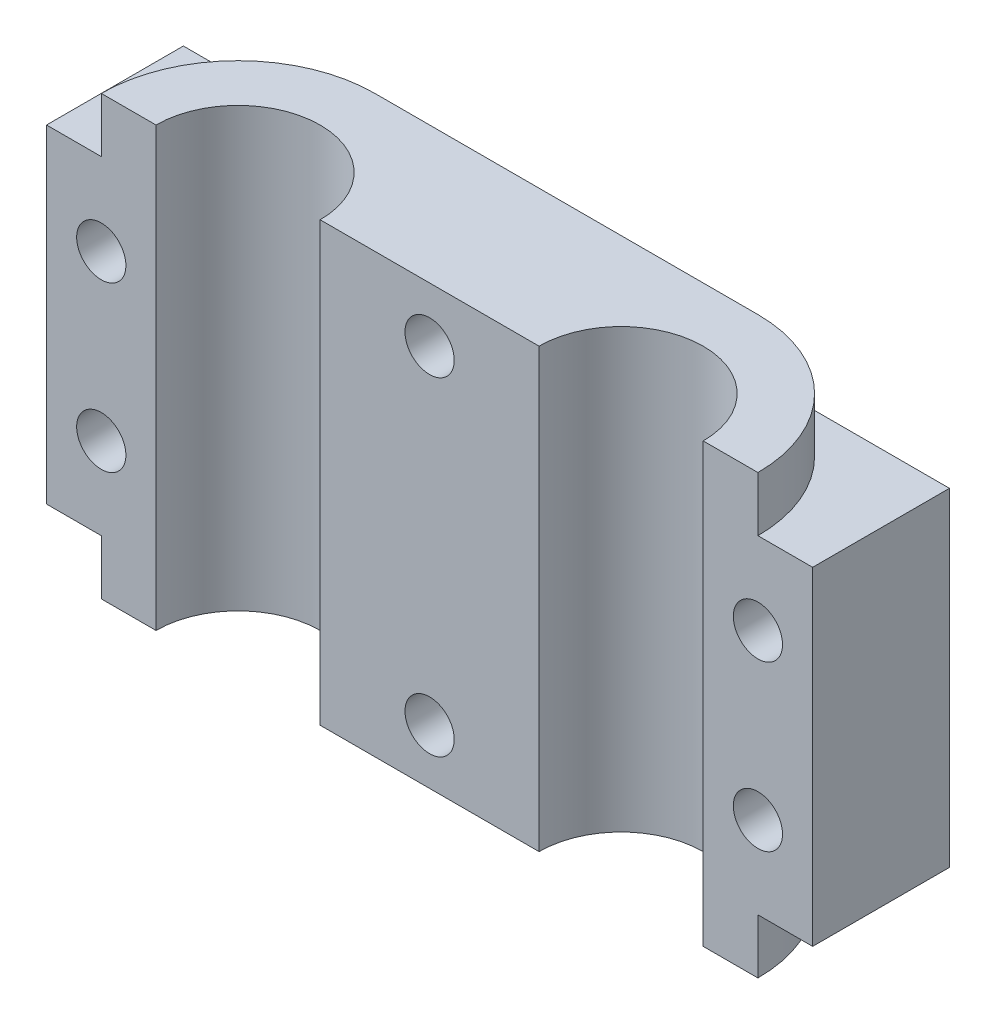
from build123d import *

# Parameters (mm, degrees)
BOSS_EXTRUDE1_DEPTH = 20
BOSS_EXTRUDE2_DEPTH = 15
SKETCH2_R           = 2.25
CUT_EXTRUDE1_DEPTH  = 12.5


with BuildPart() as part:
    # Sketch1 → Boss-Extrude1 (new, symmetric)
    with BuildSketch(Plane(origin=(0, 0, 0), x_dir=(1, 0, 0), z_dir=(0, 1, 0))):
        with BuildLine():
            ThreePointArc((-17.5, 0), (-26.338834765, -3.661165235), (-30, -12.5))
            Line((-30, -12.5), (-25, -12.5))
            ThreePointArc((-25, -12.5), (-17.5, -5), (-10, -12.5))
            Line((-10, -12.5), (10, -12.5))
            ThreePointArc((10, -12.5), (17.5, -5), (25, -12.5))
            Line((25, -12.5), (30, -12.5))
            ThreePointArc((30, -12.5), (26.338834765, -3.661165235), (17.5, 0))
            Line((17.5, 0), (-17.5, 0))
        make_face()
    extrude(amount=BOSS_EXTRUDE1_DEPTH, both=True)

    # Sketch1<3> → Boss-Extrude2 (add, symmetric)
    with BuildSketch(Plane(origin=(0, 0, 0), x_dir=(1, 0, 0), z_dir=(0, 1, 0))):
        with BuildLine():
            Line((-17.5, 0), (-35, 0))
            Line((-35, 0), (-35, -12.5))
            Line((-35, -12.5), (-30, -12.5))
            ThreePointArc((-30, -12.5), (-26.338834765, -3.661165235), (-17.5, 0))
        make_face()
        with BuildLine():
            Line((35, 0), (17.5, 0))
            ThreePointArc((17.5, 0), (26.338834765, -3.661165235), (30, -12.5))
            Line((30, -12.5), (35, -12.5))
            Line((35, -12.5), (35, 0))
        make_face()
    extrude(amount=BOSS_EXTRUDE2_DEPTH, both=True)

    # Sketch2 → Cut-Extrude1 (cut)
    with BuildSketch(Plane.XY.offset(12.5)):
        with Locations((0, 15)):
            Circle(SKETCH2_R)
        with Locations((0, -15)):
            Circle(SKETCH2_R)
        with Locations((-30, 7.5)):
            Circle(SKETCH2_R)
        with Locations((-30, -7.5)):
            Circle(SKETCH2_R)
        with Locations((30, -7.5)):
            Circle(SKETCH2_R)
        with Locations((30, 7.5)):
            Circle(SKETCH2_R)
    extrude(amount=-CUT_EXTRUDE1_DEPTH, mode=Mode.SUBTRACT)


solid = part.part
